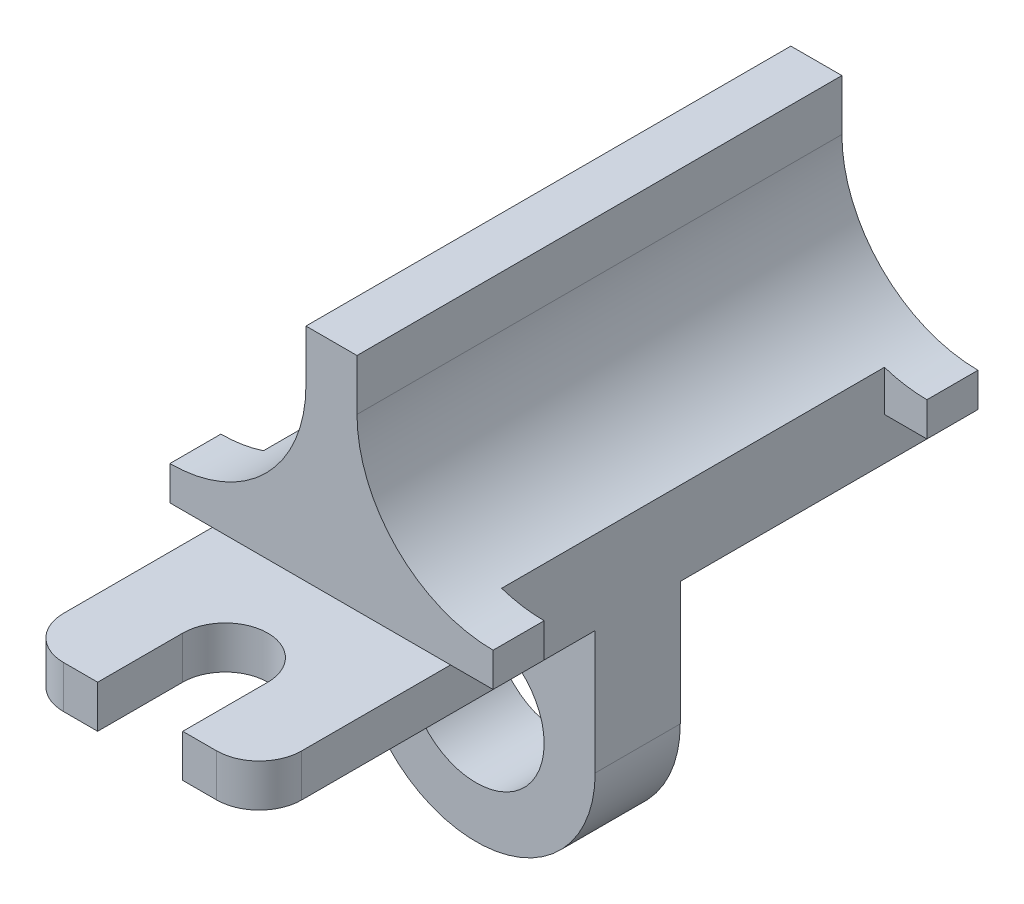
from build123d import *

# Parameters (mm, degrees)
BOSS_EXTRUDE3_DEPTH      = 89
BOSS_EXTRUDE3_DEPTH_BACK = 70
SKETCH7_W                = 56
SKETCH7_H                = 10
BOSS_EXTRUDE4_DEPTH      = 44
BOSS_EXTRUDE4_DEPTH_BACK = 70
BOSS_EXTRUDE5_DEPTH      = 10
BOSS_EXTRUDE5_DEPTH_BACK = 10
SKETCH1_R                = 16
CUT_EXTRUDE1_REACH       = 131.484
FILLET1_R                = 10
CUT_EXTRUDE3_REACH       = 131.484
SKETCH10_W               = 10
SKETCH10_H               = 90


with BuildPart() as part:
    # Sketch7 → Boss-Extrude3 (new, two sides: drawn at the far end of the back side and taken through both)
    with BuildSketch(Plane.XY.offset(-BOSS_EXTRUDE3_DEPTH_BACK)):
        with Locations((28, 34)):
            Rectangle(SKETCH7_W, SKETCH7_H)
    extrude(amount=BOSS_EXTRUDE3_DEPTH + BOSS_EXTRUDE3_DEPTH_BACK)

    # Sketch5 → Boss-Extrude4 (add, two sides: drawn at the far end of the back side and taken through both)
    with BuildSketch(Plane.XY.offset(-BOSS_EXTRUDE4_DEPTH_BACK)):
        with BuildLine():
            Line((22, 79), (22, 91))
            Line((22, 91), (34, 91))
            Line((34, 91), (34, 79))
            ThreePointArc((34, 79), (43.372583002, 56.372583002), (66, 47))
            Line((66, 47), (66, 39))
            Line((66, 39), (-10, 39))
            Line((-10, 39), (-10, 47))
            ThreePointArc((-10, 47), (12.627416998, 56.372583002), (22, 79))
        make_face()
    extrude(amount=BOSS_EXTRUDE4_DEPTH + BOSS_EXTRUDE4_DEPTH_BACK)

    # Sketch1 → Boss-Extrude5 (add, two sides: drawn at the far end of the back side and taken through both)
    with BuildSketch(Plane.XY.offset(-BOSS_EXTRUDE5_DEPTH_BACK)):
        with BuildLine():
            Line((0, 0), (0, 29))
            Line((0, 29), (56, 29))
            Line((56, 29), (56, 0))
            ThreePointArc((56, 0), (28, -28), (0, 0))
        make_face()
        with Locations((28, 0)):
            Circle(SKETCH1_R, mode=Mode.SUBTRACT)
    extrude(amount=BOSS_EXTRUDE5_DEPTH + BOSS_EXTRUDE5_DEPTH_BACK)

    # Sketch9 → Cut-Extrude1 (cut, up to next)
    with BuildSketch(Plane(origin=(0, 39, 0), x_dir=(1, 0, 0), z_dir=(0, 1, 0)), mode=Mode.PRIVATE) as cut_extrude1_sk1:
        with BuildLine():
            Line((38.033469933, -69), (38.033469933, -89))
            Line((38.033469933, -89), (18.033469933, -89))
            Line((18.033469933, -89), (18.033469933, -69))
            ThreePointArc((18.033469933, -69), (28.033469933, -59), (38.033469933, -69))
        make_face()
    cut_extrude1_tool1 = extrude(cut_extrude1_sk1.sketch, amount=-CUT_EXTRUDE1_REACH, mode=Mode.PRIVATE) & part.part
    add(cut_extrude1_tool1.solids().sort_by_distance((28.03347, 39, 74.983585))[0], mode=Mode.SUBTRACT)

    # Fillet1
    fillet1_edges = [part.edges().sort_by_distance(p)[0] for p in [
        (56, 34, 89),
        (0, 34, 89),
    ]]
    fillet(fillet1_edges, radius=FILLET1_R)

    # Sketch10 → Cut-Extrude3 (cut, up to next)
    with BuildSketch(Plane.XZ.offset(-39), mode=Mode.PRIVATE) as cut_extrude3_sk1:
        with Locations((-5, -13)):
            Rectangle(SKETCH10_W, SKETCH10_H)
    cut_extrude3_tool1 = extrude(cut_extrude3_sk1.sketch, amount=-CUT_EXTRUDE3_REACH, mode=Mode.PRIVATE) & part.part
    # Sketch10 → Cut-Extrude3 (cut, up to next)
    with BuildSketch(Plane.XZ.offset(-39), mode=Mode.PRIVATE) as cut_extrude3_sk2:
        with Locations((61, -13)):
            Rectangle(SKETCH10_W, SKETCH10_H)
    cut_extrude3_tool2 = extrude(cut_extrude3_sk2.sketch, amount=-CUT_EXTRUDE3_REACH, mode=Mode.PRIVATE) & part.part
    add(cut_extrude3_tool1.solids().sort_by_distance((-5, 39, -13))[0], mode=Mode.SUBTRACT)
    add(cut_extrude3_tool2.solids().sort_by_distance((61, 39, -13))[0], mode=Mode.SUBTRACT)


solid = part.part
